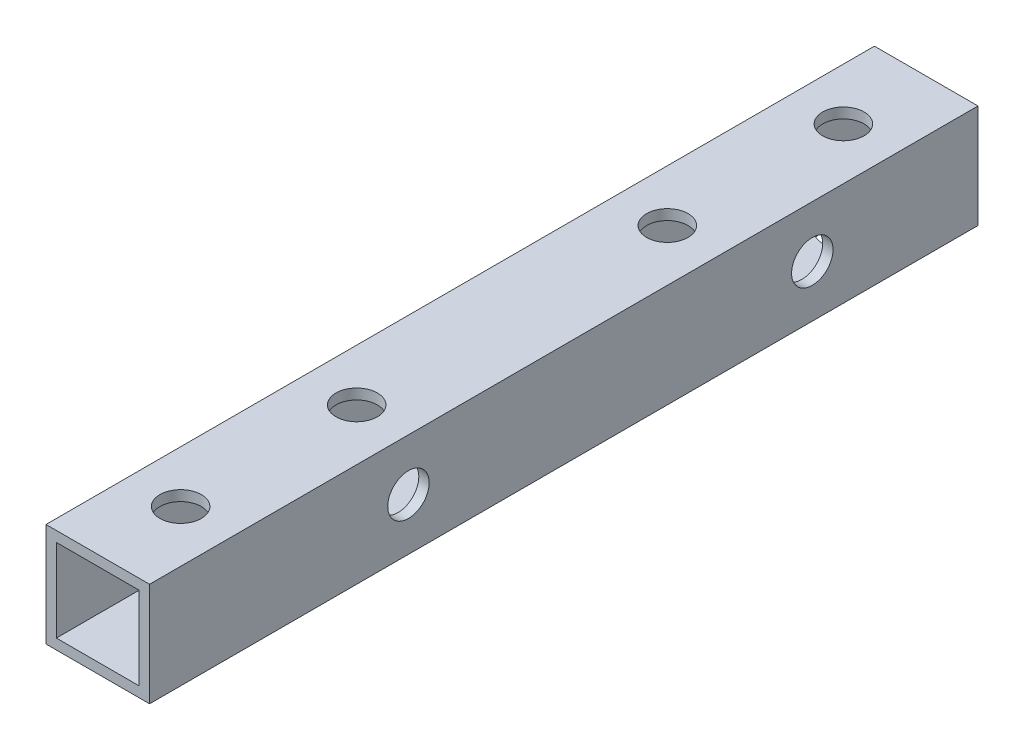
from build123d import *

# Parameters (mm, degrees)
SKETCH_1_W          = 10
SKETCH_1_H          = 10
SKETCH_1_W_2        = 8
SKETCH_1_H_2        = 8
EXTRUDE_2_DEPTH     = 80
SKETCH_2_R          = 2
CUT_EXTRUDE_1_DEPTH = 70
SKETCH_3_R          = 2
CUT_EXTRUDE_2_DEPTH = 104
SKETCH_4_R          = 2
CUT_EXTRUDE_3_DEPTH = 104
SKETCH_5_R          = 2
CUT_EXTRUDE_4_DEPTH = 100
SKETCH_6_R          = 2
CUT_EXTRUDE_5_DEPTH = 10


with BuildPart() as part:
    # 草图1 → 凸台-拉伸2 (new body)
    with BuildSketch(Plane.XY):
        with Locations((5, 5)):
            Rectangle(SKETCH_1_W, SKETCH_1_H)
        with Locations((5, 5)):
            Rectangle(SKETCH_1_W_2, SKETCH_1_H_2, mode=Mode.SUBTRACT)
    extrude(amount=EXTRUDE_2_DEPTH)

    # 草图2 → 切除-拉伸1 (cut)
    with BuildSketch(Plane(origin=(0, 10, 0), x_dir=(1, 0, 0), z_dir=(0, 1, 0))):
        with Locations(Location((5, -72, 0), (0, 0, 180))):
            Circle(SKETCH_2_R)
        with Locations(Location((5, -8, 0), (0, 0, 180))):
            Circle(SKETCH_2_R)
    extrude(amount=-CUT_EXTRUDE_1_DEPTH, mode=Mode.SUBTRACT)

    # 草图3 → 切除-拉伸2 (cut)
    with BuildSketch(Plane.XZ):
        with Locations((5, 25)):
            Circle(SKETCH_3_R)
    extrude(amount=-CUT_EXTRUDE_2_DEPTH, mode=Mode.SUBTRACT)

    # 草图4 → 切除-拉伸3 (cut)
    with BuildSketch(Plane.XZ):
        with Locations((5, 55)):
            Circle(SKETCH_4_R)
    extrude(amount=-CUT_EXTRUDE_3_DEPTH, mode=Mode.SUBTRACT)

    # 草图5 → 切除-拉伸4 (cut)
    with BuildSketch(Plane(origin=(10, 0, 0), x_dir=(0, 0, -1), z_dir=(1, 0, 0))):
        with Locations(Location((-16, 5, 0), (0, 0, 90))):
            Circle(SKETCH_5_R)
    extrude(amount=-CUT_EXTRUDE_4_DEPTH, mode=Mode.SUBTRACT)

    # 草图6 → 切除-拉伸5 (cut)
    with BuildSketch(Plane.ZY):
        with Locations(Location((55, 5, 0), (0, 0, 270))):
            Circle(SKETCH_6_R)
    extrude(amount=-CUT_EXTRUDE_5_DEPTH, mode=Mode.SUBTRACT)


solid = part.part
